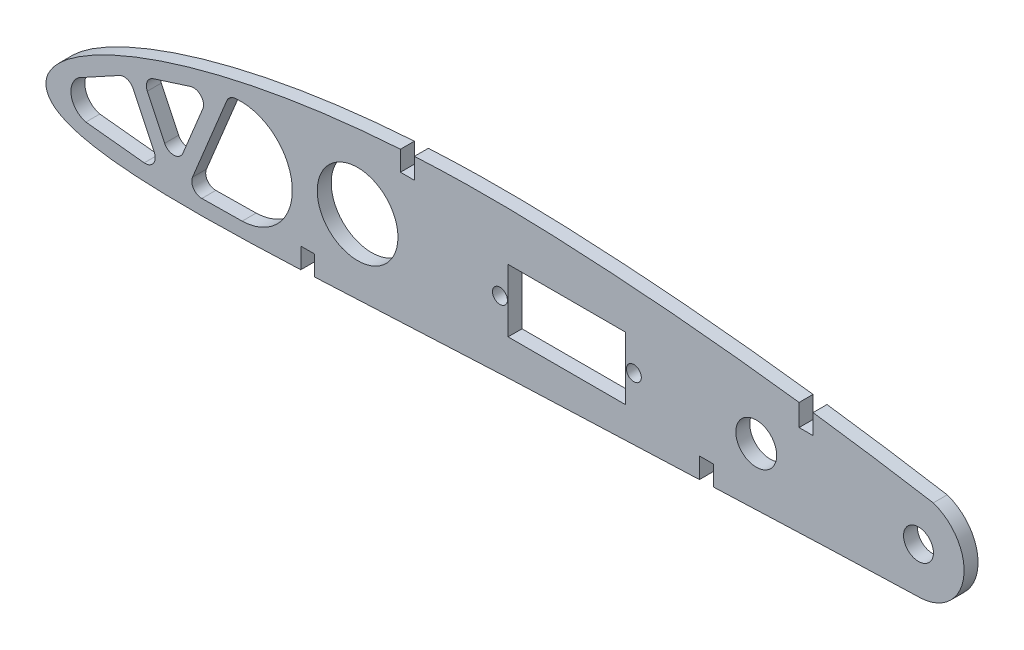
from build123d import *

# Parameters (mm, degrees)
SKETCH_2_R      = 8.1
SKETCH_2_R_2    = 1.5
SKETCH_2_W      = 23.6
SKETCH_2_H      = 12.6
SKETCH_2_R_3    = 4.1
SKETCH_2_R_4    = 3
EXTRUDE_2_DEPTH = 1.4


with BuildPart() as part:
    # Эскиз2 → Бобышка-Вытянуть2 (new, symmetric)
    # profile 1 of 4: a face of its own
    with BuildSketch(Plane.XY):
        with BuildLine():
            Line((165.940456932, 7.493910465), (165.940456932, 18.08535451))
            add(Edge.make_bspline(
                [(165.940456927, 18.085354477), (165.930512982, 18.086853188), (163.740114219, 18.416932942), (159.739714866, 19.000386852), (155.744292591, 19.547112651), (153.932619318, 19.787470759)],
                knots=[0.332761263, 0.332761263, 0.332761263, 0.332761263, 0.332878042, 0.358484538, 0.379707003, 0.379707003, 0.379707003, 0.379707003], degree=3))
            Line((153.932619318, 19.787470759), (153.932619318, 15.787470759))
            Line((153.932619318, 15.787470759), (151.132619318, 15.787470759))
            Line((151.132619318, 15.787470759), (151.132619318, 20.152925753))
            add(Edge.make_bspline(
                [(151.132619318, 20.152925753), (149.51271539, 20.360855756), (145.712882211, 20.834305053), (139.731359791, 21.525676112), (133.19183673, 22.212004248), (126.658683026, 22.825721427), (120.136770918, 23.363973264), (113.62856714, 23.824677322), (107.152732037, 24.200242592), (100.741095693, 24.498399508), (94.411752715, 24.686649766), (88.155917993, 24.740095648), (81.949043055, 24.658849141), (77.212383792, 24.491578654), (74.545027167, 24.35694527), (73.932619318, 24.323871534)],
                knots=[0.390637302, 0.390637302, 0.390637302, 0.390637302, 0.409602822, 0.435103874, 0.460559416, 0.485959195, 0.51130307, 0.536551515, 0.561723366, 0.586628867, 0.611085431, 0.6352512, 0.659272176, 0.683163753, 0.690285585, 0.690285585, 0.690285585, 0.690285585], degree=3))
            Line((73.932619318, 24.323871534), (73.932619318, 20.157469486))
            Line((73.932619318, 20.157469486), (71.132619318, 20.157469486))
            Line((71.132619318, 20.157469486), (71.132619318, 24.157469486))
            add(Edge.make_bspline(
                [(71.132619318, 24.157469486), (70.635982629, 24.125241372), (68.110579653, 23.953963558), (63.575410502, 23.578006358), (57.555189551, 22.924946655), (51.605762689, 22.119065518), (45.744400312, 21.156564429), (39.995857594, 20.035371386), (34.397919843, 18.75631623), (29.010382104, 17.327615604), (23.925798409, 15.771864917), (19.27067884, 14.13426943), (15.179098392, 12.483335433), (11.740475791, 10.89561099), (8.959371869, 9.429577361), (6.760891181, 8.108603195), (5.033709749, 6.92463805), (3.671694934, 5.85422966), (2.592101124, 4.871305364), (1.738175669, 3.952595739), (1.069870831, 3.080946369), (0.571645411, 2.241622098), (0.2157739, 1.430785392), (0.102255582, 0.88324169), (0.047975001, 0.621424995)],
                knots=[0.701142916, 0.701142916, 0.701142916, 0.701142916, 0.706922144, 0.73053591, 0.7539832, 0.77723469, 0.800246382, 0.822950709, 0.845237155, 0.866915896, 0.887662335, 0.906968281, 0.924203157, 0.938878975, 0.950931611, 0.960693484, 0.968646729, 0.975232933, 0.980794744, 0.985583761, 0.989781539, 0.993521313, 0.996902113, 1, 1, 1, 1], degree=3))
            add(Edge.make_bspline(
                [(0.047975001, 0.621424995), (0.022713821, 0.373490081), (-0.027820788, -0.12249998), (0.077991213, -0.884434595), (0.349695651, -1.638838075), (0.814331136, -2.365068928), (1.463480781, -3.039275249), (2.290973018, -3.660999474), (3.305928751, -4.235779626), (4.53525562, -4.773674148), (6.029745689, -5.282192169), (7.868981216, -5.765316681), (10.168831393, -6.221716597), (13.07543819, -6.639618735), (16.728115364, -6.992956742), (21.189952097, -7.247345149), (26.399984417, -7.376638853), (32.197398565, -7.376256917), (38.39780676, -7.261436583), (44.752137938, -7.05998551), (49.023344092, -6.886827907), (51.132619318, -6.795360627)],
                knots=[0, 0, 0, 0, 0.002941446, 0.005884319, 0.00901613, 0.012364547, 0.016007934, 0.020036845, 0.024573728, 0.029783835, 0.03589701, 0.04324044, 0.052275965, 0.063634589, 0.077983176, 0.095698161, 0.116520086, 0.13966073, 0.16431217, 0.18991889, 0.214908072, 0.214908072, 0.214908072, 0.214908072], degree=3))
            Line((51.132619318, -6.795360627), (51.132619318, -2.670677263))
            Line((51.132619318, -2.670677263), (53.932619318, -2.670677263))
            Line((53.932619318, -2.670677263), (53.932619318, -6.670677263))
            add(Edge.make_bspline(
                [(53.932619318, -6.670677263), (55.356569482, -6.605720394), (59.058679651, -6.431131786), (65.052094606, -6.13285227), (71.91077271, -5.784005184), (78.771375577, -5.439680462), (85.61049861, -5.110951262), (92.43210759, -4.804953337), (99.255031191, -4.531981668), (106.097378406, -4.278274685), (112.969211681, -4.003089942), (119.864404255, -3.723176202), (125.92308308, -3.47492717), (129.679854903, -3.321735217), (131.132619318, -3.262735091)],
                knots=[0.225966113, 0.225966113, 0.225966113, 0.225966113, 0.242837762, 0.269833583, 0.296993022, 0.324123272, 0.351139107, 0.378035509, 0.404946016, 0.431960837, 0.459078395, 0.4863474, 0.51364083, 0.530850189, 0.530850189, 0.530850189, 0.530850189], degree=3))
            Line((131.132619318, -3.262735091), (131.132619318, 0.850647814))
            Line((131.132619318, 0.850647814), (133.932619318, 0.850647814))
            Line((133.932619318, 0.850647814), (133.932619318, -3.149352186))
            add(Edge.make_bspline(
                [(133.932619318, -3.149352186), (136.150252366, -3.05984138), (140.66441482, -2.879164577), (147.472013762, -2.613922958), (154.352602411, -2.355626415), (160.507662095, -2.135075484), (164.369425992, -2.00299999), (165.940456932, -1.950382964)],
                knots=[0.541906346, 0.541906346, 0.541906346, 0.541906346, 0.568176028, 0.595379569, 0.622543445, 0.64967326, 0.668278692, 0.668278692, 0.668278692, 0.668278692], degree=3))
            Line((165.940456932, -1.950382964), (165.940456932, 7.493910465))
        make_face()
        with BuildLine():
            ThreePointArc((14.721240391, 8.766081587), (16.29867531, 8.913940332), (17.488708089, 7.868002897))
            Line((17.488708089, 7.868002897), (21.725441093, -1.073266618))
            ThreePointArc((21.725441093, -1.073266618), (21.549996986, -3.085882804), (19.709418924, -3.918755509))
            Line((19.709418924, -3.918755509), (7.999391348, -2.690370853))
            ThreePointArc((7.999391348, -2.690370853), (5.078852056, 0.362162442), (6.580135706, 4.311042875))
            Line((6.580135706, 4.311042875), (14.721240391, 8.766081587))
        make_face(mode=Mode.SUBTRACT)
        with BuildLine():
            Line((23.813024955, 1.527110532), (20.342244628, 8.85190119))
            ThreePointArc((20.342244628, 8.85190119), (20.315234657, 10.50521233), (21.542097769, 11.613803404))
            Line((21.542097769, 11.613803404), (29.003823035, 13.992759157))
            ThreePointArc((29.003823035, 13.992759157), (31.082028751, 13.44264333), (31.461008962, 11.326528867))
            Line((31.461008962, 11.326528867), (27.470064023, 1.622782457))
            ThreePointArc((27.470064023, 1.622782457), (25.672695714, 0.384197539), (23.813024955, 1.527110532))
        make_face(mode=Mode.SUBTRACT)
        with BuildLine():
            ThreePointArc((31.277857225, -4.328453595), (29.59717908, -3.452864074), (29.401621993, -1.567898965))
            Line((29.401621993, -1.567898965), (36.28872379, 15.177681436))
            ThreePointArc((36.28872379, 15.177681436), (36.93262885, 16.01260855), (37.911651949, 16.404055587))
            ThreePointArc((37.911651949, 16.404055587), (49.40696202, 6.85120019), (39.366777065, -4.221012142))
            Line((39.366777065, -4.221012142), (31.277857225, -4.328453595))
        make_face(mode=Mode.SUBTRACT)
        with Locations((62.532619318, 8.592254753)):
            Circle(SKETCH_2_R, mode=Mode.SUBTRACT)
        with Locations((91.097584877, 8.663246996)):
            Circle(SKETCH_2_R_2, mode=Mode.SUBTRACT)
        with Locations((104.532584877, 8.646041596)):
            Rectangle(SKETCH_2_W, SKETCH_2_H, mode=Mode.SUBTRACT)
        with Locations((117.967584877, 8.663246996)):
            Circle(SKETCH_2_R_2, mode=Mode.SUBTRACT)
        with Locations((142.532619318, 8.694705966)):
            Circle(SKETCH_2_R_3, mode=Mode.SUBTRACT)
    # profile 2 of 4: a face of its own
    with BuildSketch(Plane.XY):
        with BuildLine():
            ThreePointArc((175.09133409, 16.644787515), (168.620686836, 13.964557687), (165.940456932, 7.493910465))
            ThreePointArc((165.940456932, 7.493910465), (168.62068676, 1.023263102), (175.091334091, -1.656966802))
            add(Edge.make_bspline(
                [(175.091334091, -1.656966802), (175.277208172, -1.651281031), (175.463082779, -1.645612457), (175.648957912, -1.639961136)],
                knots=[0.704401069, 0.704401069, 0.704401069, 0.704401069, 0.706602137, 0.706602137, 0.706602137, 0.706602137], degree=3))
            ThreePointArc((175.648957912, -1.639961136), (181.75621593, 1.223511419), (184.242211249, 7.493910357))
            ThreePointArc((184.242211249, 7.493910357), (182.535436414, 12.815930026), (178.051789748, 16.152677882))
            add(Edge.make_bspline(
                [(178.051789748, 16.152677882), (177.065313176, 16.318762985), (176.078492678, 16.482805505), (175.091334086, 16.644787486)],
                knots=[0.285286421, 0.285286421, 0.285286421, 0.285286421, 0.296903142, 0.296903142, 0.296903142, 0.296903142], degree=3))
        make_face()
        with Locations((175.091334091, 7.493910357)):
            Circle(SKETCH_2_R_4, mode=Mode.SUBTRACT)
    # profile 3 of 4: a face of its own
    with BuildSketch(Plane.XY):
        with BuildLine():
            add(Edge.make_bspline(
                [(175.091334086, 16.644787486), (174.212389383, 16.789012746), (171.164330743, 17.283350355), (168.11310015, 17.757902557), (165.940456927, 18.085354477)],
                knots=[0.296903142, 0.296903142, 0.296903142, 0.296903142, 0.30724642, 0.332761263, 0.332761263, 0.332761263, 0.332761263], degree=3))
            Line((165.940456932, 18.08535451), (165.940456932, 7.493910465))
            ThreePointArc((165.940456932, 7.493910465), (168.620686836, 13.964557687), (175.09133409, 16.644787515))
        make_face()
    # profile 4 of 4: a face of its own
    with BuildSketch(Plane.XY):
        with BuildLine():
            ThreePointArc((175.091334091, -1.656966802), (168.62068676, 1.023263102), (165.940456932, 7.493910465))
            Line((165.940456932, 7.493910465), (165.940456932, -1.950382964))
            add(Edge.make_bspline(
                [(165.940456932, -1.950382964), (166.657896825, -1.926354441), (169.661989692, -1.826713582), (172.712313278, -1.729793129), (175.045239361, -1.65837681), (175.091334091, -1.656966802)],
                knots=[0.668278692, 0.668278692, 0.668278692, 0.668278692, 0.676775201, 0.703855228, 0.704401069, 0.704401069, 0.704401069, 0.704401069], degree=3))
        make_face()
    extrude(amount=EXTRUDE_2_DEPTH, both=True)


solid = part.part
